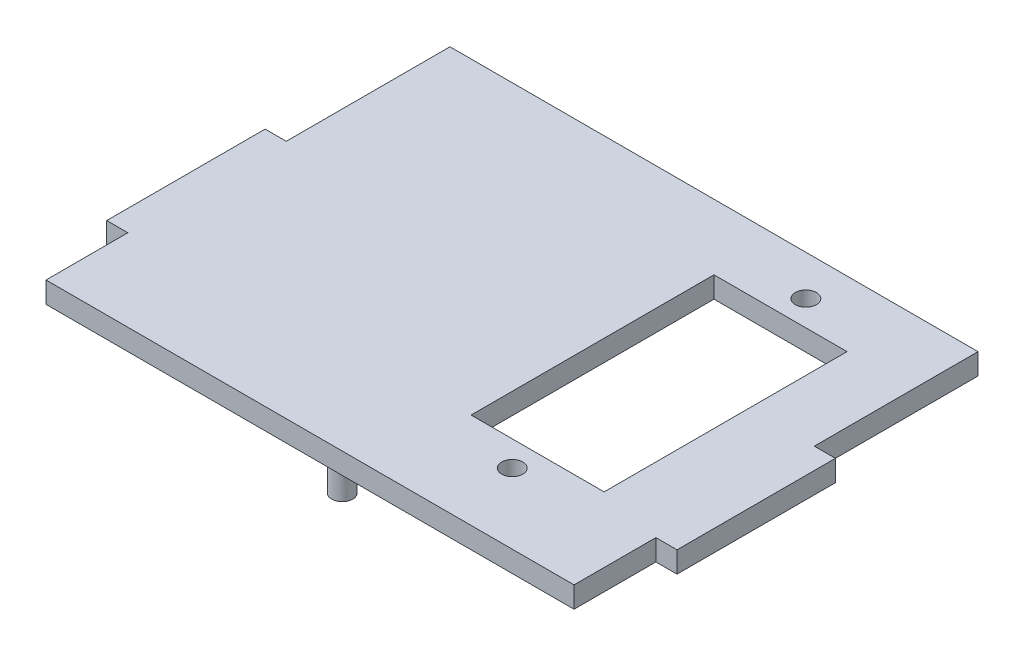
from build123d import *

# Parameters (mm, degrees)
SKETCH1_R           = 1
BOSS_EXTRUDE1_DEPTH = 2
SKETCH2_R           = 1
BOSS_EXTRUDE2_DEPTH = 17
SKETCH3_W           = 50
SKETCH3_H           = 7.75
CUT_EXTRUDE1_DEPTH  = 2


with BuildPart() as part:
    # Sketch1 → Boss-Extrude1 (new body)
    with BuildSketch(Plane(origin=(0, 0, 0), x_dir=(1, 0, 0), z_dir=(0, 1, 0))):
        Polygon((-25, 23), (25, 23), (25, 7.5), (27, 7.5), (27, -7.5), (25, -7.5), (25, -23), (-25, -23), (-25, -7.5), (-27, -7.5), (-27, 7.5), (-25, 7.5), align=None)
        with Locations(Location((12.5, 19.2, 0), (0, 0, 270))):
            Circle(SKETCH1_R, mode=Mode.SUBTRACT)
        with Locations(Location((12.5, -8.6, 0), (0, 0, 90))):
            Circle(SKETCH1_R, mode=Mode.SUBTRACT)
        Polygon((6.2, 16.8), (6.2, 6.2), (6.2, -6.2), (18.8, -6.2), (18.8, 6.2), (18.8, 16.8), align=None, mode=Mode.SUBTRACT)
    extrude(amount=BOSS_EXTRUDE1_DEPTH)

    # Sketch2 → Boss-Extrude2 (add)
    with BuildSketch(Plane.XZ):
        with Locations(Location((-12.5, -0.300349058, 0), (0, 0, 90))):
            Circle(SKETCH2_R)
    extrude(amount=BOSS_EXTRUDE2_DEPTH)

    # Sketch3 → Cut-Extrude1 (cut)
    with BuildSketch(Plane.XZ):
        with Locations((0, 19.125)):
            Rectangle(SKETCH3_W, SKETCH3_H)
    extrude(amount=-CUT_EXTRUDE1_DEPTH, mode=Mode.SUBTRACT)


solid = part.part
